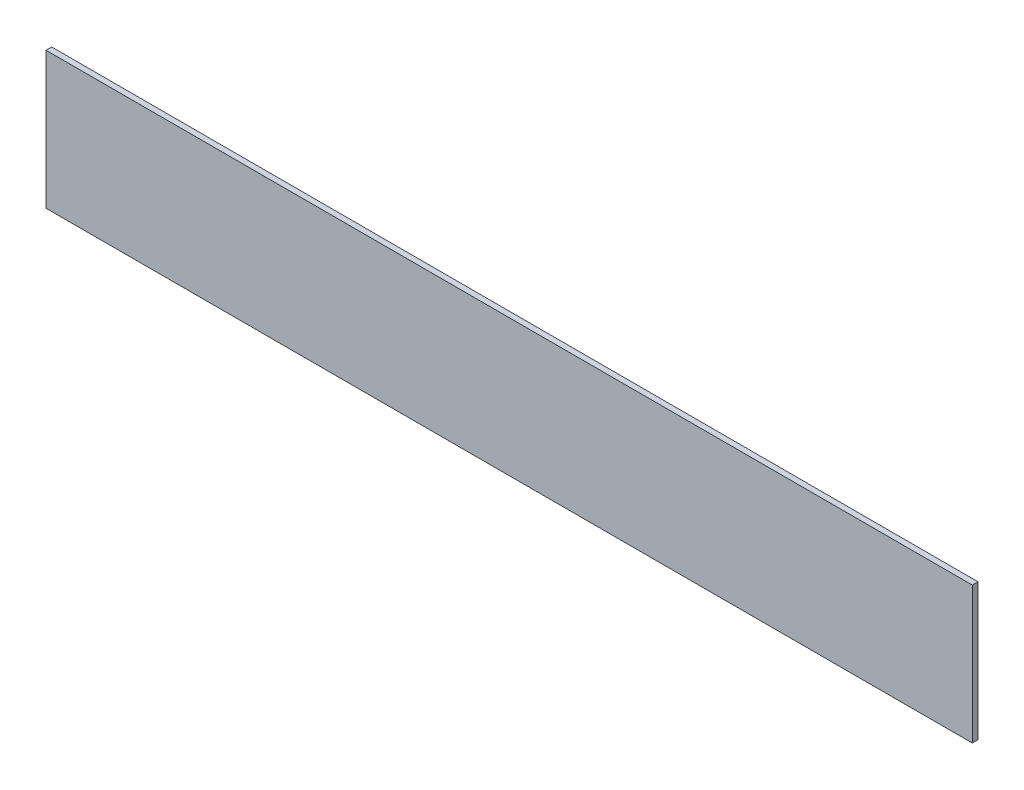
from build123d import *

# Parameters (mm, degrees)
SKETCH1_W           = 1031.748
SKETCH1_H           = 152.4
BOSS_EXTRUDE1_DEPTH = 6.35


with BuildPart() as part:
    # Sketch1 → Boss-Extrude1 (new body)
    with BuildSketch(Plane.XY):
        Rectangle(SKETCH1_W, SKETCH1_H)
    extrude(amount=BOSS_EXTRUDE1_DEPTH)


solid = part.part
